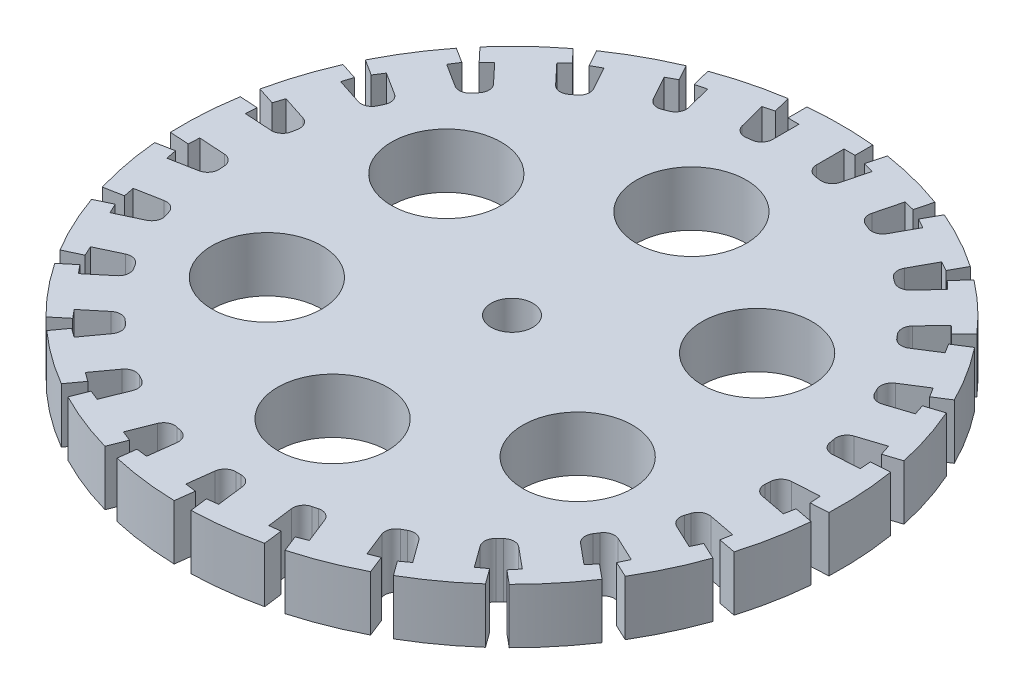
from build123d import *

# Parameters (mm, degrees)
BOSS_EXTRUDE2_DEPTH = 6.35
FILLET2_R           = 1.27
FILLET3_R           = 1.27
CUT_EXTRUDE1_REACH  = 56.254
SKETCH2_R           = 2.413
SKETCH2_R_2         = 6.35


with BuildPart() as part:
    # Sketch1 → Boss-Extrude2 (new body)
    with BuildSketch(Plane(origin=(0, 0, 0), x_dir=(1, 0, 0), z_dir=(0, 1, 0))):
        with BuildLine():
            Line((-2.54, 31.528459964), (-2.54, 35.718625011))
            Line((-2.54, 35.718625011), (-3.81, 35.718625011))
            Line((-3.81, 35.718625011), (-3.81, 37.909021354))
            ThreePointArc((-3.81, 37.909021354), (0, 38.1), (3.81, 37.909021354))
            Line((3.81, 37.909021354), (3.81, 35.847599361))
            Line((3.81, 35.847599361), (2.54, 35.847599361))
            Line((2.54, 35.847599361), (2.54, 31.528459964))
            ThreePointArc((2.54, 31.528459964), (3.96436643, 31.381191604), (5.380607922, 31.169607731))
            Line((5.380607922, 31.169607731), (6.422659594, 35.228131037))
            Line((6.422659594, 35.228131037), (5.19255898, 35.543967194))
            Line((5.19255898, 35.543967194), (5.737288399, 37.665548208))
            ThreePointArc((5.737288399, 37.665548208), (9.475084701, 36.903018439), (13.117892087, 35.770531268))
            Line((13.117892087, 35.770531268), (12.605237284, 33.773872638))
            Line((12.605237284, 33.773872638), (11.375136669, 34.089708794))
            Line((11.375136669, 34.089708794), (10.30101038, 29.906263104))
            ThreePointArc((10.30101038, 29.906263104), (11.644003568, 29.409395924), (12.963132459, 28.85225441))
            Line((12.963132459, 28.85225441), (14.981759865, 32.524124031))
            Line((14.981759865, 32.524124031), (13.868850382, 33.135951197))
            Line((13.868850382, 33.135951197), (14.924081868, 35.055410145))
            ThreePointArc((14.924081868, 35.055410145), (18.354814983, 33.38728451), (21.60153877, 31.384447148))
            Line((21.60153877, 31.384447148), (20.608441151, 29.578009285))
            Line((20.608441151, 29.578009285), (19.495531667, 30.189836451))
            Line((19.495531667, 30.189836451), (17.414770394, 26.404945745))
            ThreePointArc((17.414770394, 26.404945745), (18.592005138, 25.589699737), (19.731135709, 24.722007834))
            Line((19.731135709, 24.722007834), (22.599501065, 27.776506696))
            Line((22.599501065, 27.776506696), (21.673710908, 28.645881521))
            Line((21.673710908, 28.645881521), (23.173140386, 30.242611737))
            ThreePointArc((23.173140386, 30.242611737), (26.081244736, 27.773704705), (28.727881327, 25.02636279))
            Line((28.727881327, 25.02636279), (27.316740867, 23.523650829))
            Line((27.316740867, 23.523650829), (26.390950711, 24.393025653))
            Line((26.390950711, 24.393025653), (23.434296336, 21.244508535))
            ThreePointArc((23.434296336, 21.244508535), (24.371802648, 20.162108604), (25.259359136, 19.038386584))
            Line((25.259359136, 19.038386584), (28.797232498, 21.283589291))
            Line((28.797232498, 21.283589291), (28.116732468, 22.355885757))
            Line((28.116732468, 22.355885757), (29.966145269, 23.529558809))
            ThreePointArc((29.966145269, 23.529558809), (32.168893962, 20.415000889), (34.049145446, 17.095780017))
            Line((34.049145446, 17.095780017), (32.308629291, 15.991214877))
            Line((32.308629291, 15.991214877), (31.628129262, 17.063511342))
            Line((31.628129262, 17.063511342), (27.981359255, 14.749200722))
            ThreePointArc((27.981359255, 14.749200722), (28.620230165, 13.467658036), (29.200444132, 12.158513487))
            Line((29.200444132, 12.158513487), (33.185527904, 13.453345695))
            Line((33.185527904, 13.453345695), (32.793076321, 14.661187471))
            Line((32.793076321, 14.661187471), (34.876267036, 15.338057166))
            ThreePointArc((34.876267036, 15.338057166), (36.235253271, 11.773547486), (37.230976533, 8.091006511))
            Line((37.230976533, 8.091006511), (35.270447714, 7.453992083))
            Line((35.270447714, 7.453992083), (34.877996131, 8.661833859))
            Line((34.877996131, 8.661833859), (30.770250463, 7.327146384))
            ThreePointArc((30.770250463, 7.327146384), (31.070343363, 5.926984983), (31.30675783, 4.514676271))
            Line((31.30675783, 4.514676271), (35.488654544, 4.777778911))
            Line((35.488654544, 4.777778911), (35.408910584, 6.045272857))
            Line((35.408910584, 6.045272857), (37.59498468, 6.182808981))
            ThreePointArc((37.59498468, 6.182808981), (38.024818353, 2.392318794), (38.073448439, -1.42215469))
            Line((38.073448439, -1.42215469), (36.016094192, -1.551592448))
            Line((36.016094192, -1.551592448), (35.936350232, -0.284098502))
            Line((35.936350232, -0.284098502), (31.62573367, -0.555299509))
            ThreePointArc((31.62573367, -0.555299509), (31.568192619, -1.986102334), (31.445952797, -3.412834658))
            Line((31.445952797, -3.412834658), (35.5618985, -4.197993293))
            Line((35.5618985, -4.197993293), (35.79987277, -2.950488484))
            Line((35.79987277, -2.950488484), (37.951471172, -3.360927831))
            ThreePointArc((37.951471172, -3.360927831), (37.425144253, -7.139228086), (36.523625555, -10.845956681))
            Line((36.523625555, -10.845956681), (34.498717013, -10.459684718))
            Line((34.498717013, -10.459684718), (34.736691282, -9.21217991))
            Line((34.736691282, -9.21217991), (30.494055718, -8.402853892))
            ThreePointArc((30.494055718, -8.402853892), (30.082496232, -9.774395538), (29.609282898, -11.125904634))
            Line((29.609282898, -11.125904634), (33.400657587, -12.909990139))
            Line((33.400657587, -12.909990139), (33.941397287, -11.760859783))
            Line((33.941397287, -11.760859783), (35.923327154, -12.693485186))
            ThreePointArc((35.923327154, -12.693485186), (34.473910699, -16.222191009), (32.678888953, -19.588267326))
            Line((32.678888953, -19.588267326), (30.813658567, -18.71055653))
            Line((30.813658567, -18.71055653), (31.354398267, -17.561426173))
            Line((31.354398267, -17.561426173), (27.446324097, -15.722426061))
            ThreePointArc((27.446324097, -15.722426061), (26.706605972, -16.948527522), (25.91215286, -18.139893104))
            Line((25.91215286, -18.139893104), (29.140730518, -20.810804826))
            Line((29.140730518, -20.810804826), (29.950258985, -19.832253008))
            Line((29.950258985, -19.832253008), (31.637988375, -21.228464184))
            ThreePointArc((31.637988375, -21.228464184), (29.35655455, -24.285854009), (26.780817573, -27.099775094))
            Line((26.780817573, -27.099775094), (25.192464628, -25.785775262))
            Line((25.192464628, -25.785775262), (26.001993095, -24.807223444))
            Line((26.001993095, -24.807223444), (22.674038992, -22.054100377))
            ThreePointArc((22.674038992, -22.054100377), (21.652641438, -23.057721189), (20.58686696, -24.014085376))
            Line((20.58686696, -24.014085376), (23.049784179, -27.404000108))
            Line((23.049784179, -27.404000108), (24.077235762, -26.657512838))
            Line((24.077235762, -26.657512838), (25.364718429, -28.429580704))
            ThreePointArc((25.364718429, -28.429580704), (22.394618112, -30.823547486), (19.200008932, -32.908504327))
            Line((19.200008932, -32.908504327), (17.988335486, -31.240778902))
            Line((17.988335486, -31.240778902), (19.015787069, -30.494291631))
            Line((19.015787069, -30.494291631), (16.477060628, -27.000034458))
            ThreePointArc((16.477060628, -27.000034458), (15.23816181, -27.718113434), (13.968032495, -28.379384347))
            Line((13.968032495, -28.379384347), (15.510535129, -32.275301279))
            Line((15.510535129, -32.275301279), (16.691351266, -31.807783097))
            Line((16.691351266, -31.807783097), (17.49768994, -33.844362112))
            ThreePointArc((17.49768994, -33.844362112), (14.025545457, -35.424484112), (10.412793117, -36.649471203))
            Line((10.412793117, -36.649471203), (9.653933068, -34.732809507))
            Line((9.653933068, -34.732809507), (10.834749205, -34.265291325))
            Line((10.834749205, -34.265291325), (9.244767947, -30.249457074))
            ThreePointArc((9.244767947, -30.249457074), (7.866212434, -30.636874671), (6.471535178, -30.961502227))
            Line((6.471535178, -30.961502227), (6.996702112, -35.11862657))
            Line((6.996702112, -35.11862657), (8.256687783, -34.959453364))
            Line((8.256687783, -34.959453364), (8.53121724, -37.132577778))
            ThreePointArc((8.53121724, -37.132577778), (4.775196199, -37.79957012), (0.971303216, -38.087617017))
            Line((0.971303216, -38.087617017), (0.712938531, -36.042449953))
            Line((0.712938531, -36.042449953), (1.972924202, -35.883276746))
            Line((1.972924202, -35.883276746), (1.431592495, -31.598195053))
            ThreePointArc((1.431592495, -31.598195053), (0, -31.630608399), (-1.431592495, -31.598195053))
            Line((-1.431592495, -31.598195053), (-1.95675943, -35.755319397))
            Line((-1.95675943, -35.755319397), (-0.696773759, -35.914492604))
            Line((-0.696773759, -35.914492604), (-0.971303216, -38.087617017))
            ThreePointArc((-0.971303216, -38.087617017), (-4.775196199, -37.79957012), (-8.53121724, -37.132577778))
            Line((-8.53121724, -37.132577778), (-8.272852555, -35.087410713))
            Line((-8.272852555, -35.087410713), (-7.012866885, -35.246583919))
            Line((-7.012866885, -35.246583919), (-6.471535178, -30.961502227))
            ThreePointArc((-6.471535178, -30.961502227), (-7.866212434, -30.636874671), (-9.244767947, -30.249457074))
            Line((-9.244767947, -30.249457074), (-10.78727058, -34.145374007))
            Line((-10.78727058, -34.145374007), (-9.606454443, -34.612892189))
            Line((-9.606454443, -34.612892189), (-10.412793117, -36.649471203))
            ThreePointArc((-10.412793117, -36.649471203), (-14.025545457, -35.424484112), (-17.49768994, -33.844362112))
            Line((-17.49768994, -33.844362112), (-16.738829891, -31.927700416))
            Line((-16.738829891, -31.927700416), (-15.558013754, -32.395218597))
            Line((-15.558013754, -32.395218597), (-13.968032495, -28.379384347))
            ThreePointArc((-13.968032495, -28.379384347), (-15.23816181, -27.718113434), (-16.477060628, -27.000034458))
            Line((-16.477060628, -27.000034458), (-18.939977848, -30.38994919))
            Line((-18.939977848, -30.38994919), (-17.912526265, -31.13643646))
            Line((-17.912526265, -31.13643646), (-19.200008932, -32.908504327))
            ThreePointArc((-19.200008932, -32.908504327), (-22.394618112, -30.823547486), (-25.364718429, -28.429580704))
            Line((-25.364718429, -28.429580704), (-24.153044983, -26.761855279))
            Line((-24.153044983, -26.761855279), (-23.1255934, -27.50834255))
            Line((-23.1255934, -27.50834255), (-20.58686696, -24.014085376))
            ThreePointArc((-20.58686696, -24.014085376), (-21.652641438, -23.057721189), (-22.674038992, -22.054100377))
            Line((-22.674038992, -22.054100377), (-25.90261665, -24.725012099))
            Line((-25.90261665, -24.725012099), (-25.093088183, -25.703563918))
            Line((-25.093088183, -25.703563918), (-26.780817573, -27.099775094))
            ThreePointArc((-26.780817573, -27.099775094), (-29.35655455, -24.285854009), (-31.637988375, -21.228464184))
            Line((-31.637988375, -21.228464184), (-30.04963543, -19.914464353))
            Line((-30.04963543, -19.914464353), (-29.240106963, -20.893016171))
            Line((-29.240106963, -20.893016171), (-25.91215286, -18.139893104))
            ThreePointArc((-25.91215286, -18.139893104), (-26.706605972, -16.948527522), (-27.446324097, -15.722426061))
            Line((-27.446324097, -15.722426061), (-31.237698786, -17.506511566))
            Line((-31.237698786, -17.506511566), (-30.696959086, -18.655641923))
            Line((-30.696959086, -18.655641923), (-32.678888953, -19.588267326))
            ThreePointArc((-32.678888953, -19.588267326), (-34.473910699, -16.222191009), (-35.923327154, -12.693485186))
            Line((-35.923327154, -12.693485186), (-34.058096769, -11.81577439))
            Line((-34.058096769, -11.81577439), (-33.517357068, -12.964904747))
            Line((-33.517357068, -12.964904747), (-29.609282898, -11.125904634))
            ThreePointArc((-29.609282898, -11.125904634), (-30.082496232, -9.774395538), (-30.494055718, -8.402853892))
            Line((-30.494055718, -8.402853892), (-34.610001422, -9.188012527))
            Line((-34.610001422, -9.188012527), (-34.372027153, -10.435517335))
            Line((-34.372027153, -10.435517335), (-36.523625555, -10.845956681))
            ThreePointArc((-36.523625555, -10.845956681), (-37.425144253, -7.139228086), (-37.951471172, -3.360927831))
            Line((-37.951471172, -3.360927831), (-35.92656263, -2.974655868))
            Line((-35.92656263, -2.974655868), (-35.68858836, -4.222160676))
            Line((-35.68858836, -4.222160676), (-31.445952797, -3.412834658))
            ThreePointArc((-31.445952797, -3.412834658), (-31.568192619, -1.986102334), (-31.62573367, -0.555299509))
            Line((-31.62573367, -0.555299509), (-35.807630383, -0.292196869))
            Line((-35.807630383, -0.292196869), (-35.887374343, -1.559690814))
            Line((-35.887374343, -1.559690814), (-38.073448439, -1.42215469))
            ThreePointArc((-38.073448439, -1.42215469), (-38.024818353, 2.392318794), (-37.59498468, 6.182808981))
            Line((-37.59498468, 6.182808981), (-35.537630433, 6.053371223))
            Line((-35.537630433, 6.053371223), (-35.617374393, 4.785877278))
            Line((-35.617374393, 4.785877278), (-31.30675783, 4.514676271))
            ThreePointArc((-31.30675783, 4.514676271), (-31.070343363, 5.926984983), (-30.770250463, 7.327146384))
            Line((-30.770250463, 7.327146384), (-34.755334235, 8.621978593))
            Line((-34.755334235, 8.621978593), (-35.147785818, 7.414136817))
            Line((-35.147785818, 7.414136817), (-37.230976533, 8.091006511))
            ThreePointArc((-37.230976533, 8.091006511), (-36.235253271, 11.773547486), (-34.876267036, 15.338057166))
            Line((-34.876267036, 15.338057166), (-32.915738217, 14.701042737))
            Line((-32.915738217, 14.701042737), (-33.3081898, 13.493200961))
            Line((-33.3081898, 13.493200961), (-29.200444132, 12.158513487))
            ThreePointArc((-29.200444132, 12.158513487), (-28.620230165, 13.467658036), (-27.981359255, 14.749200722))
            Line((-27.981359255, 14.749200722), (-31.519232616, 16.99440343))
            Line((-31.519232616, 16.99440343), (-32.199732646, 15.922106964))
            Line((-32.199732646, 15.922106964), (-34.049145446, 17.095780017))
            ThreePointArc((-34.049145446, 17.095780017), (-32.168893962, 20.415000889), (-29.966145269, 23.529558809))
            Line((-29.966145269, 23.529558809), (-28.225629114, 22.424993669))
            Line((-28.225629114, 22.424993669), (-28.906129143, 21.352697204))
            Line((-28.906129143, 21.352697204), (-25.259359136, 19.038386584))
            ThreePointArc((-25.259359136, 19.038386584), (-24.371802648, 20.162108604), (-23.434296336, 21.244508535))
            Line((-23.434296336, 21.244508535), (-26.302661692, 24.299007398))
            Line((-26.302661692, 24.299007398), (-27.228451849, 23.429632574))
            Line((-27.228451849, 23.429632574), (-28.727881327, 25.02636279))
            ThreePointArc((-28.727881327, 25.02636279), (-26.081244736, 27.773704705), (-23.173140386, 30.242611737))
            Line((-23.173140386, 30.242611737), (-21.761999926, 28.739899776))
            Line((-21.761999926, 28.739899776), (-22.687790083, 27.870524951))
            Line((-22.687790083, 27.870524951), (-19.731135709, 24.722007834))
            ThreePointArc((-19.731135709, 24.722007834), (-18.592005138, 25.589699737), (-17.414770394, 26.404945745))
            Line((-17.414770394, 26.404945745), (-19.4333978, 30.076815367))
            Line((-19.4333978, 30.076815367), (-20.546307284, 29.4649882))
            Line((-20.546307284, 29.4649882), (-21.60153877, 31.384447148))
            ThreePointArc((-21.60153877, 31.384447148), (-18.354814983, 33.38728451), (-14.924081868, 35.055410145))
            Line((-14.924081868, 35.055410145), (-13.930984249, 33.248972282))
            Line((-13.930984249, 33.248972282), (-15.043893733, 32.637145116))
            Line((-15.043893733, 32.637145116), (-12.963132459, 28.85225441))
            ThreePointArc((-12.963132459, 28.85225441), (-11.644003568, 29.409395924), (-10.30101038, 29.906263104))
            Line((-10.30101038, 29.906263104), (-11.343062053, 33.964786411))
            Line((-11.343062053, 33.964786411), (-12.573162667, 33.648950254))
            Line((-12.573162667, 33.648950254), (-13.117892087, 35.770531268))
            ThreePointArc((-13.117892087, 35.770531268), (-9.475084701, 36.903018439), (-5.737288399, 37.665548208))
            Line((-5.737288399, 37.665548208), (-5.224633596, 35.668889578))
            Line((-5.224633596, 35.668889578), (-6.454734211, 35.353053421))
            Line((-6.454734211, 35.353053421), (-5.380607922, 31.169607731))
            ThreePointArc((-5.380607922, 31.169607731), (-3.96436643, 31.381191604), (-2.54, 31.528459964))
        make_face()
    extrude(amount=BOSS_EXTRUDE2_DEPTH)

    # Fillet2
    fillet2_edges = [part.edges().sort_by_distance(p)[0] for p in [
        (-2.54, 3.175, -31.528459964),
        (2.54, 3.175, -31.528459964),
        (5.380607922, 3.175, -31.169607731),
        (10.30101038, 3.175, -29.906263104),
        (12.963132459, 3.175, -28.85225441),
        (17.414770394, 3.175, -26.404945745),
        (19.731135709, 3.175, -24.722007834),
        (23.434296336, 3.175, -21.244508535),
        (25.259359136, 3.175, -19.038386584),
        (27.981359255, 3.175, -14.749200722),
        (29.200444132, 3.175, -12.158513487),
        (30.770250463, 3.175, -7.327146384),
        (31.30675783, 3.175, -4.514676271),
        (31.62573367, 3.175, 0.555299509),
        (31.445952797, 3.175, 3.412834658),
        (30.494055718, 3.175, 8.402853892),
        (29.609282898, 3.175, 11.125904634),
        (27.446324097, 3.175, 15.722426061),
        (25.91215286, 3.175, 18.139893104),
        (22.674038992, 3.175, 22.054100377),
        (20.58686696, 3.175, 24.014085376),
        (16.477060628, 3.175, 27.000034458),
        (13.968032495, 3.175, 28.379384347),
        (9.244767947, 3.175, 30.249457074),
        (6.471535178, 3.175, 30.961502227),
        (1.431592495, 3.175, 31.598195053),
        (-1.431592495, 3.175, 31.598195053),
        (-6.471535178, 3.175, 30.961502227),
        (-9.244767947, 3.175, 30.249457074),
        (-13.968032495, 3.175, 28.379384347),
        (-16.477060628, 3.175, 27.000034458),
        (-20.58686696, 3.175, 24.014085376),
        (-22.674038992, 3.175, 22.054100377),
        (-25.91215286, 3.175, 18.139893104),
        (-27.446324097, 3.175, 15.722426061),
        (-30.494055718, 3.175, 8.402853892),
        (-31.62573367, 3.175, 0.555299509),
        (-30.770250463, 3.175, -7.327146384),
        (-29.200444132, 3.175, -12.158513487),
        (-27.981359255, 3.175, -14.749200722),
        (-25.259359136, 3.175, -19.038386584),
        (-23.434296336, 3.175, -21.244508535),
        (-19.731135709, 3.175, -24.722007834),
        (-17.414770394, 3.175, -26.404945745),
        (-12.963132459, 3.175, -28.85225441),
        (-10.30101038, 3.175, -29.906263104),
        (-5.380607922, 3.175, -31.169607731),
    ]]
    fillet(fillet2_edges, radius=FILLET2_R)

    # Fillet3
    fillet3_edges = [part.edges().sort_by_distance(p)[0] for p in [
        (-29.609282898, 3.175, 11.125904634),
        (-31.445952797, 3.175, 3.412834658),
        (-31.30675783, 3.175, -4.514676271),
    ]]
    fillet(fillet3_edges, radius=FILLET3_R)

    # Sketch2 → Cut-Extrude1 (cut, up to next)
    with BuildSketch(Plane(origin=(0, 6.35, 0), x_dir=(1, 0, 0), z_dir=(0, 1, 0)), mode=Mode.PRIVATE) as cut_extrude1_sk1:
        with Locations(Location((0, 0, 0), (0, 0, 270))):
            Circle(SKETCH2_R)
    cut_extrude1_tool1 = extrude(cut_extrude1_sk1.sketch, amount=-CUT_EXTRUDE1_REACH, mode=Mode.PRIVATE) & part.part
    # Sketch2 → Cut-Extrude1 (cut, up to next)
    with BuildSketch(Plane(origin=(0, 6.35, 0), x_dir=(1, 0, 0), z_dir=(0, 1, 0)), mode=Mode.PRIVATE) as cut_extrude1_sk2:
        with Locations(Location((0, 20.747039709, 0), (0, 0, 270))):
            Circle(SKETCH2_R_2)
    cut_extrude1_tool2 = extrude(cut_extrude1_sk2.sketch, amount=-CUT_EXTRUDE1_REACH, mode=Mode.PRIVATE) & part.part
    # Sketch2 → Cut-Extrude1 (cut, up to next)
    with BuildSketch(Plane(origin=(0, 6.35, 0), x_dir=(1, 0, 0), z_dir=(0, 1, 0)), mode=Mode.PRIVATE) as cut_extrude1_sk3:
        with Locations(Location((17.967463441, 10.373519854, 0), (0, 0, 270))):
            Circle(SKETCH2_R_2)
    cut_extrude1_tool3 = extrude(cut_extrude1_sk3.sketch, amount=-CUT_EXTRUDE1_REACH, mode=Mode.PRIVATE) & part.part
    # Sketch2 → Cut-Extrude1 (cut, up to next)
    with BuildSketch(Plane(origin=(0, 6.35, 0), x_dir=(1, 0, 0), z_dir=(0, 1, 0)), mode=Mode.PRIVATE) as cut_extrude1_sk4:
        with Locations(Location((17.967463441, -10.373519854, 0), (0, 0, 270))):
            Circle(SKETCH2_R_2)
    cut_extrude1_tool4 = extrude(cut_extrude1_sk4.sketch, amount=-CUT_EXTRUDE1_REACH, mode=Mode.PRIVATE) & part.part
    # Sketch2 → Cut-Extrude1 (cut, up to next)
    with BuildSketch(Plane(origin=(0, 6.35, 0), x_dir=(1, 0, 0), z_dir=(0, 1, 0)), mode=Mode.PRIVATE) as cut_extrude1_sk5:
        with Locations(Location((0, -20.747039709, 0), (0, 0, 270))):
            Circle(SKETCH2_R_2)
    cut_extrude1_tool5 = extrude(cut_extrude1_sk5.sketch, amount=-CUT_EXTRUDE1_REACH, mode=Mode.PRIVATE) & part.part
    # Sketch2 → Cut-Extrude1 (cut, up to next)
    with BuildSketch(Plane(origin=(0, 6.35, 0), x_dir=(1, 0, 0), z_dir=(0, 1, 0)), mode=Mode.PRIVATE) as cut_extrude1_sk6:
        with Locations(Location((-17.967463441, -10.373519854, 0), (0, 0, 270))):
            Circle(SKETCH2_R_2)
    cut_extrude1_tool6 = extrude(cut_extrude1_sk6.sketch, amount=-CUT_EXTRUDE1_REACH, mode=Mode.PRIVATE) & part.part
    # Sketch2 → Cut-Extrude1 (cut, up to next)
    with BuildSketch(Plane(origin=(0, 6.35, 0), x_dir=(1, 0, 0), z_dir=(0, 1, 0)), mode=Mode.PRIVATE) as cut_extrude1_sk7:
        with Locations(Location((-17.967463441, 10.373519854, 0), (0, 0, 270))):
            Circle(SKETCH2_R_2)
    cut_extrude1_tool7 = extrude(cut_extrude1_sk7.sketch, amount=-CUT_EXTRUDE1_REACH, mode=Mode.PRIVATE) & part.part
    add(cut_extrude1_tool1.solids().sort_by_distance((0, 6.35, 0))[0], mode=Mode.SUBTRACT)
    add(cut_extrude1_tool2.solids().sort_by_distance((0, 6.35, -20.74704))[0], mode=Mode.SUBTRACT)
    add(cut_extrude1_tool3.solids().sort_by_distance((17.967463, 6.35, -10.37352))[0], mode=Mode.SUBTRACT)
    add(cut_extrude1_tool4.solids().sort_by_distance((17.967463, 6.35, 10.37352))[0], mode=Mode.SUBTRACT)
    add(cut_extrude1_tool5.solids().sort_by_distance((0, 6.35, 20.74704))[0], mode=Mode.SUBTRACT)
    add(cut_extrude1_tool6.solids().sort_by_distance((-17.967463, 6.35, 10.37352))[0], mode=Mode.SUBTRACT)
    add(cut_extrude1_tool7.solids().sort_by_distance((-17.967463, 6.35, -10.37352))[0], mode=Mode.SUBTRACT)


solid = part.part
